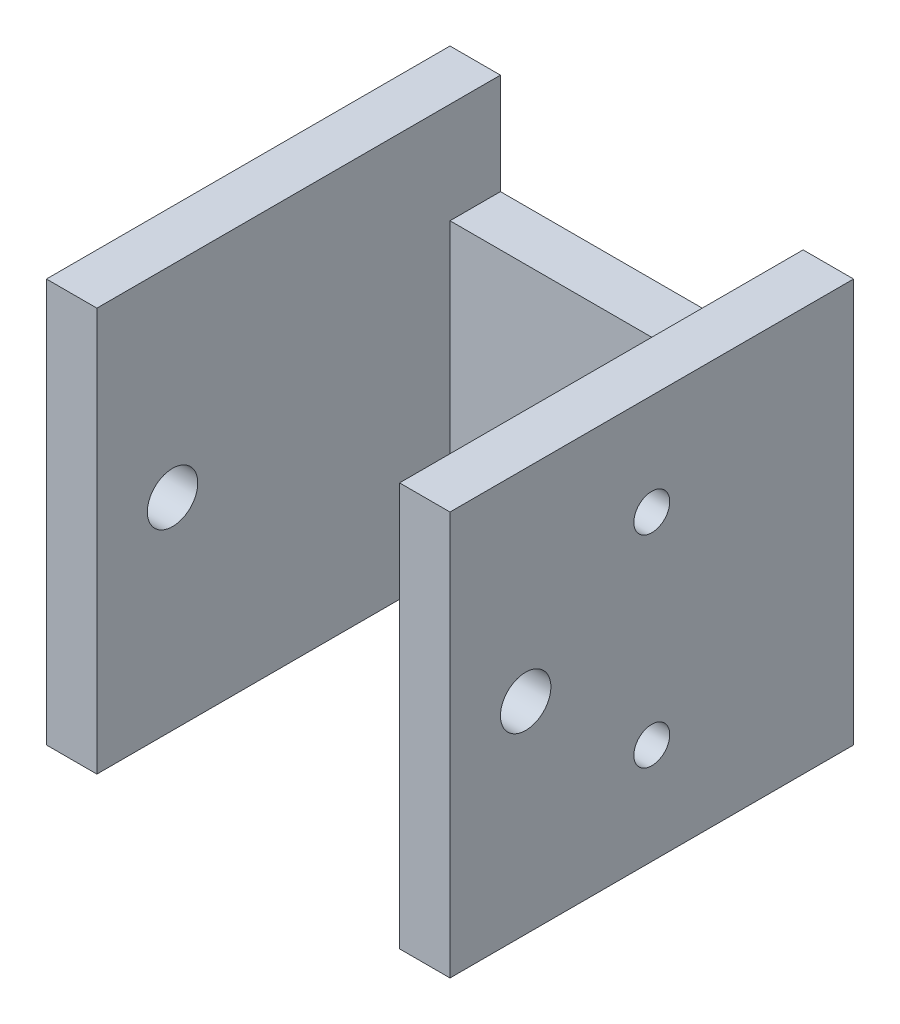
from build123d import *

# Parameters (mm, degrees)
BOSS_EXTRUDE1_DEPTH             = 25.4
F_1_8_0_125_DIAMETER_HOLE1_D    = 3.175
F_43_0_089_DIAMETER_HOLE2_D     = 2.2606
F_43_0_089_DIAMETER_HOLE2_DEPTH = 3.175
CUT_EXTRUDE1_REACH              = 44.241
SKETCH8_W                       = 19.05
SKETCH8_H                       = 6.35


with BuildPart() as part:
    # Sketch1 → Boss-Extrude1 (new body)
    with BuildSketch(Plane(origin=(0, 0, 0), x_dir=(1, 0, 0), z_dir=(0, 1, 0))):
        Polygon((0, 0), (0, 25.4), (25.4, 25.4), (25.4, 0), (22.225, 0), (22.225, 22.225), (3.175, 22.225), (3.175, 0), align=None)
    extrude(amount=BOSS_EXTRUDE1_DEPTH)

    # 1/8 (0.125) Diameter Hole1 (through all)
    with Locations(Plane.ZY):
        with Locations((-4.7625, 12.7)):
            Hole(F_1_8_0_125_DIAMETER_HOLE1_D / 2)

    # #43 (0.089) Diameter Hole2
    with Locations(Plane(origin=(25.4, 0, 0), x_dir=(0, 0, -1), z_dir=(1, 0, 0))):
        with Locations((12.7, 19.05), (12.7, 6.35)):
            Hole(F_43_0_089_DIAMETER_HOLE2_D / 2, depth=F_43_0_089_DIAMETER_HOLE2_DEPTH)

    # Sketch8 → Cut-Extrude1 (cut, up to next)
    with BuildSketch(Plane.XY.offset(-22.225), mode=Mode.PRIVATE) as cut_extrude1_sk1:
        with Locations((12.7, 22.225)):
            Rectangle(SKETCH8_W, SKETCH8_H)
    cut_extrude1_tool1 = extrude(cut_extrude1_sk1.sketch, amount=-CUT_EXTRUDE1_REACH, mode=Mode.PRIVATE) & part.part
    # Sketch8 → Cut-Extrude1 (cut, up to next)
    with BuildSketch(Plane.XY.offset(-22.225), mode=Mode.PRIVATE) as cut_extrude1_sk2:
        with Locations((12.7, 3.175)):
            Rectangle(SKETCH8_W, SKETCH8_H)
    cut_extrude1_tool2 = extrude(cut_extrude1_sk2.sketch, amount=-CUT_EXTRUDE1_REACH, mode=Mode.PRIVATE) & part.part
    add(cut_extrude1_tool1.solids().sort_by_distance((12.7, 22.225, -22.225))[0], mode=Mode.SUBTRACT)
    add(cut_extrude1_tool2.solids().sort_by_distance((12.7, 3.175, -22.225))[0], mode=Mode.SUBTRACT)


solid = part.part
